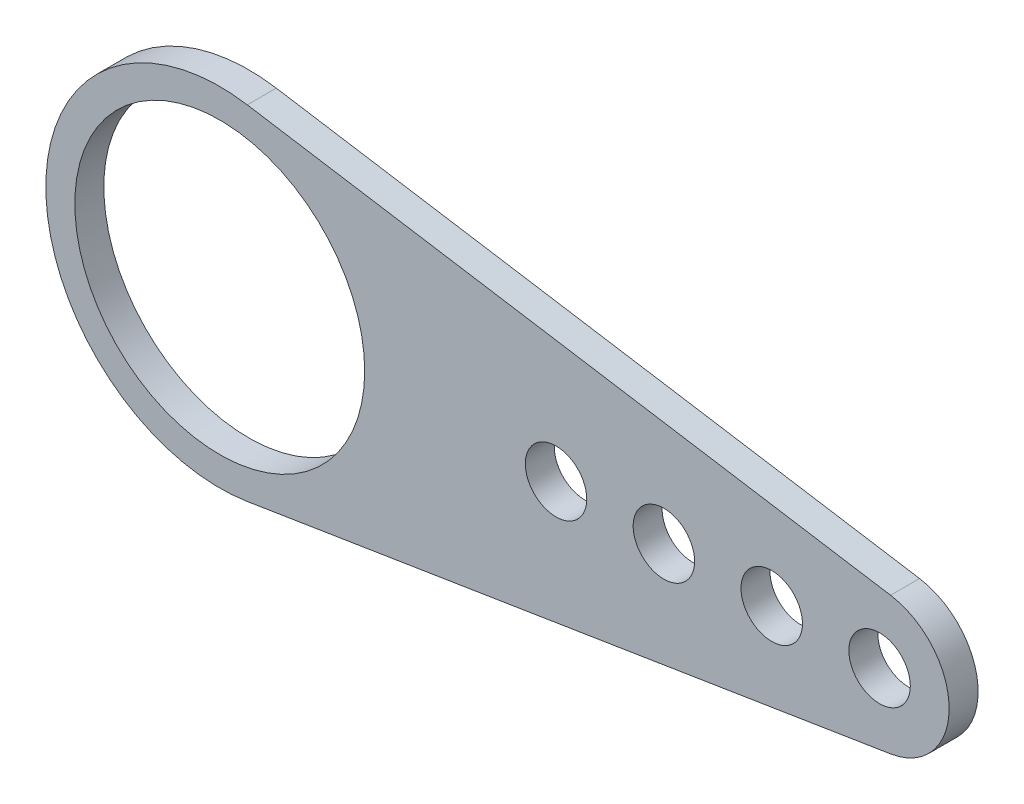
from build123d import *

# Parameters (mm, degrees)
FLAT_SKETCH_R           = 19.05
FLAT_SKETCH_R_2         = 15.875
FLAT_SKETCH_R_3         = 7.62
FLAT_SKETCH_R_4         = 3.3655
EXTRUDE_FACE_DEPTH      = 3.175
FLAT_SKETCH_4_R         = 3.3655
EXTRUDE_CUT_HOLES_DEPTH = 3.175


with BuildPart() as part:
    # Flat sketch → Extrude face (new body)
    # profile 1 of 7: a face of its own
    with BuildSketch(Plane.XY):
        Circle(FLAT_SKETCH_R)
        Circle(FLAT_SKETCH_R_2, mode=Mode.SUBTRACT)
    # profile 2 of 7: a face of its own
    with BuildSketch(Plane.XY):
        with Locations((72.263, 0)):
            Circle(FLAT_SKETCH_R_3)
        with Locations((72.263, 0)):
            Circle(FLAT_SKETCH_R_4, mode=Mode.SUBTRACT)
    # profile 3 of 7: a face of its own
    with BuildSketch(Plane.XY):
        with Locations((72.263, 0)):
            Circle(FLAT_SKETCH_R_4)
    # profile 4 of 7: a face of its own
    with BuildSketch(Plane.XY):
        with BuildLine():
            Line((73.468272408, 7.524075918), (3.013181019, 18.810189796))
            ThreePointArc((3.013181019, 18.810189796), (14.49661337, 12.359235445), (19.05, 0))
            ThreePointArc((19.05, 0), (14.49661337, -12.359235445), (3.013181019, -18.810189796))
            Line((3.013181019, -18.810189796), (73.468272408, -7.524075918))
            ThreePointArc((73.468272408, -7.524075918), (64.643, 0), (73.468272408, 7.524075918))
        make_face()
        with Locations((36.83, 0)):
            Circle(FLAT_SKETCH_R_4, mode=Mode.SUBTRACT)
        with Locations((48.641, 0)):
            Circle(FLAT_SKETCH_R_4, mode=Mode.SUBTRACT)
        with Locations((60.452, 0)):
            Circle(FLAT_SKETCH_R_4, mode=Mode.SUBTRACT)
    # profile 5 of 7: a face of its own
    with BuildSketch(Plane.XY):
        with Locations((60.452, 0)):
            Circle(FLAT_SKETCH_R_4)
    # profile 6 of 7: a face of its own
    with BuildSketch(Plane.XY):
        with Locations((48.641, 0)):
            Circle(FLAT_SKETCH_R_4)
    # profile 7 of 7: a face of its own
    with BuildSketch(Plane.XY):
        with Locations((36.83, 0)):
            Circle(FLAT_SKETCH_R_4)
    extrude(amount=EXTRUDE_FACE_DEPTH)

    # Flat sketch<4> → Extrude cut - holes (cut)
    with BuildSketch(Plane.XY):
        with Locations((72.263, 0)):
            Circle(FLAT_SKETCH_4_R)
        with Locations((60.452, 0)):
            Circle(FLAT_SKETCH_4_R)
        with Locations((48.641, 0)):
            Circle(FLAT_SKETCH_4_R)
        with Locations((36.83, 0)):
            Circle(FLAT_SKETCH_4_R)
    extrude(amount=EXTRUDE_CUT_HOLES_DEPTH, mode=Mode.SUBTRACT)


solid = part.part
